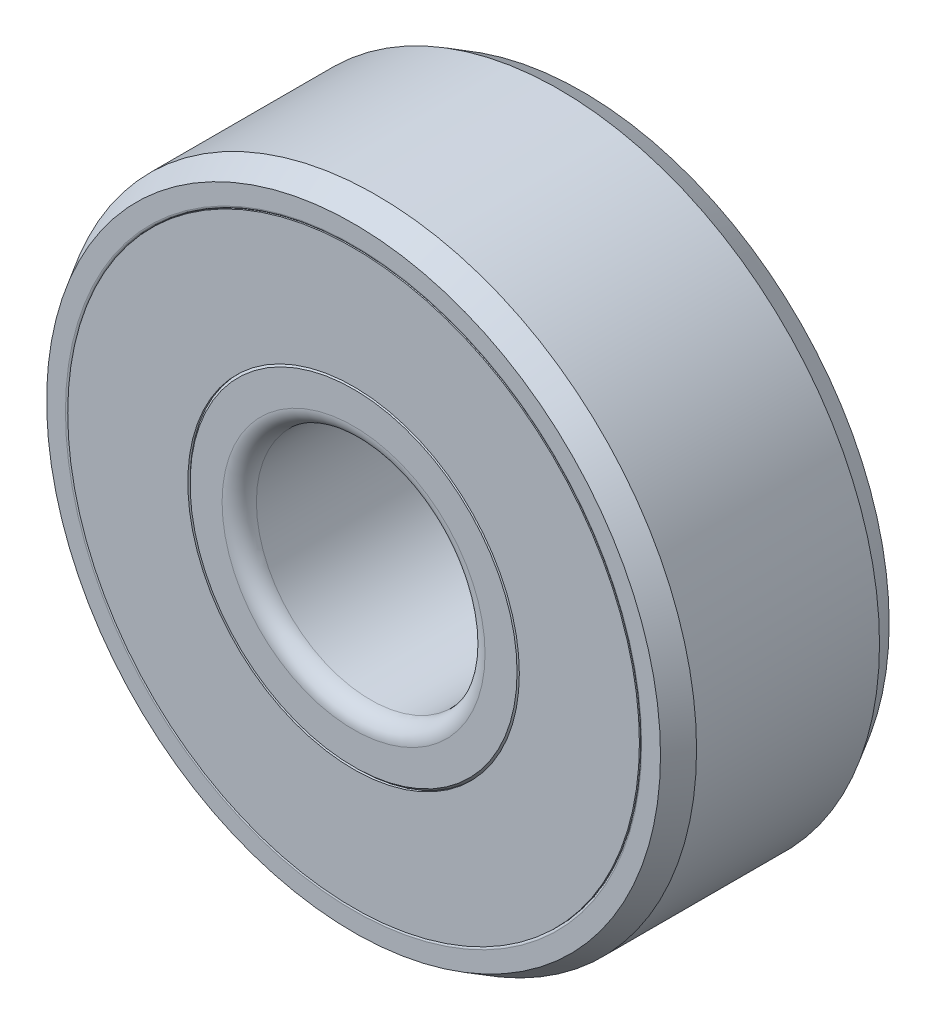
from build123d import *

# Parameters (mm, degrees)
SKETCH4_W         = 0.515625
SKETCH4_H         = 2.625
CIRPATTERN1_COUNT = 7


with BuildPart() as part:
    # Sketch3 → Revolve1 (revolve)
    with BuildSketch(Plane(origin=(0, 0, 0), x_dir=(0, 0, -1), z_dir=(1, 0, 0)), mode=Mode.PRIVATE) as revolve1_sk:
        with BuildLine():
            Line((-2, -7), (2, -7))
            Line((2, -7), (2.5, -6.711324865))
            Line((2.5, -6.711324865), (2.5, -6.3))
            ThreePointArc((2.5, -6.3), (2.485355339, -6.264644661), (2.45, -6.25))
            Line((2.45, -6.25), (1.25, -6.25))
            ThreePointArc((1.25, -6.25), (0, -6.75), (-1.25, -6.25))
            Line((-1.25, -6.25), (-2.45, -6.25))
            ThreePointArc((-2.45, -6.25), (-2.485355339, -6.264644661), (-2.5, -6.3))
            Line((-2.5, -6.3), (-2.5, -6.711324865))
            Line((-2.5, -6.711324865), (-2, -7))
        make_face()
        with BuildLine():
            Line((-2.125, -2.5), (2.125, -2.5))
            ThreePointArc((2.125, -2.5), (2.390165043, -2.609834957), (2.5, -2.875))
            Line((2.5, -2.875), (2.5, -3.575))
            Line((2.5, -3.575), (2.45, -3.625))
            Line((2.45, -3.625), (1.25, -3.625))
            ThreePointArc((1.25, -3.625), (0, -3.125), (-1.25, -3.625))
            Line((-1.25, -3.625), (-2.45, -3.625))
            Line((-2.45, -3.625), (-2.5, -3.575))
            Line((-2.5, -3.575), (-2.5, -2.875))
            ThreePointArc((-2.5, -2.875), (-2.390165043, -2.609834957), (-2.125, -2.5))
        make_face()
    revolve(revolve1_sk.sketch.rotate(Axis((0, 0, 2.5), (0, 0, -1)), 270), axis=Axis((0, 0, 2.5), (0, 0, -1)))


with BuildPart() as body_2:
    # Sketch4 → Revolve2 (revolve)
    with BuildSketch(Plane(origin=(0, 0, 0), x_dir=(0, 0, -1), z_dir=(1, 0, 0)), mode=Mode.PRIVATE) as revolve2_sk:
        with Locations((-2.2421875, -4.9375)):
            Rectangle(SKETCH4_W, SKETCH4_H)
    revolve(revolve2_sk.sketch.rotate(Axis((0, 0, 2.5), (0, 0, -1)), 270), axis=Axis((0, 0, 2.5), (0, 0, -1)))


with BuildPart() as body_3:
    # Sketch5 → Revolve3 (revolve)
    with BuildSketch(Plane(origin=(0, 0, 0), x_dir=(0, 0, -1), z_dir=(1, 0, 0))):
        with BuildLine():
            Line((0, -3.125), (0, -6.75))
            ThreePointArc((0, -6.75), (-1.8125, -4.9375), (0, -3.125))
        make_face()
    revolve(axis=Axis((0, 0, 0), (0, -1, 0)))


with BuildPart() as cirpattern1_1:
    # CirPattern1: pattern copy
    add(body_3.part.rotate(Axis((0, 0, 0), (0, 0, 1)), 1 * 360 / CIRPATTERN1_COUNT))


with BuildPart() as cirpattern1_2:
    # CirPattern1: pattern copy
    add(body_3.part.rotate(Axis((0, 0, 0), (0, 0, 1)), 2 * 360 / CIRPATTERN1_COUNT))


with BuildPart() as cirpattern1_3:
    # CirPattern1: pattern copy
    add(body_3.part.rotate(Axis((0, 0, 0), (0, 0, 1)), 3 * 360 / CIRPATTERN1_COUNT))


with BuildPart() as cirpattern1_4:
    # CirPattern1: pattern copy
    add(body_3.part.rotate(Axis((0, 0, 0), (0, 0, 1)), 4 * 360 / CIRPATTERN1_COUNT))


with BuildPart() as cirpattern1_5:
    # CirPattern1: pattern copy
    add(body_3.part.rotate(Axis((0, 0, 0), (0, 0, 1)), 5 * 360 / CIRPATTERN1_COUNT))


with BuildPart() as cirpattern1_6:
    # CirPattern1: pattern copy
    add(body_3.part.rotate(Axis((0, 0, 0), (0, 0, 1)), 6 * 360 / CIRPATTERN1_COUNT))


solid = Compound([part.part, body_2.part, body_3.part, cirpattern1_1.part, cirpattern1_2.part, cirpattern1_3.part, cirpattern1_4.part, cirpattern1_5.part, cirpattern1_6.part])
